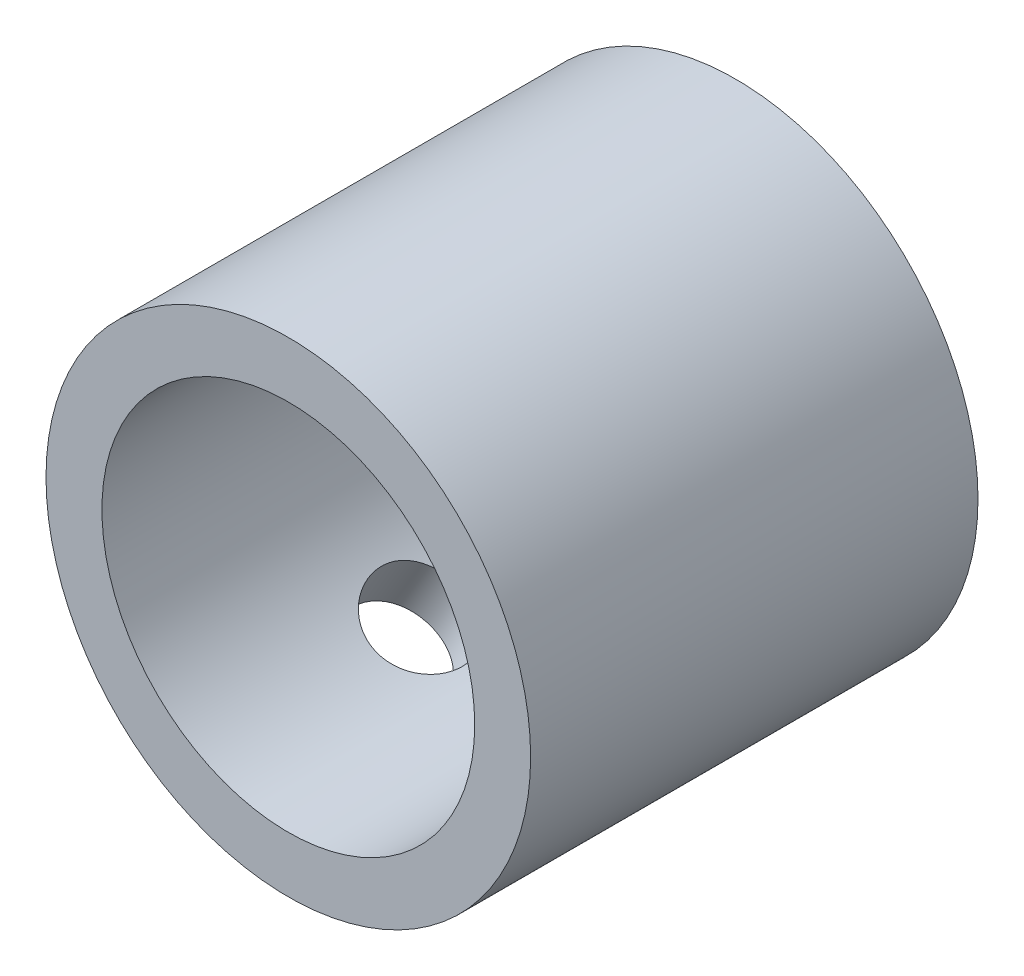
from build123d import *

# Parameters (mm, degrees)
SKETCH1_R           = 6.5
SKETCH1_R_2         = 5
BOSS_EXTRUDE1_DEPTH = 12


with BuildPart() as part:
    # Sketch1 → Boss-Extrude1 (new body)
    with BuildSketch(Plane.XY):
        Circle(SKETCH1_R)
        Circle(SKETCH1_R_2, mode=Mode.SUBTRACT)
    extrude(amount=BOSS_EXTRUDE1_DEPTH)

    # Sketch2 → Cut-Revolve1 (revolve, cut)
    with BuildSketch(Plane.XY.offset(6)):
        Polygon((-0.764638776, -3.82439321), (-2.706497931, -7.187791926), (-3.789029685, -6.562791926), (-1.847170531, -3.19939321), align=None)
    revolve(axis=Axis((-3.789029685, -6.562791926, 6), (0.5000000000000001, 0.8660254037844386, 0)), mode=Mode.SUBTRACT)


solid = part.part
